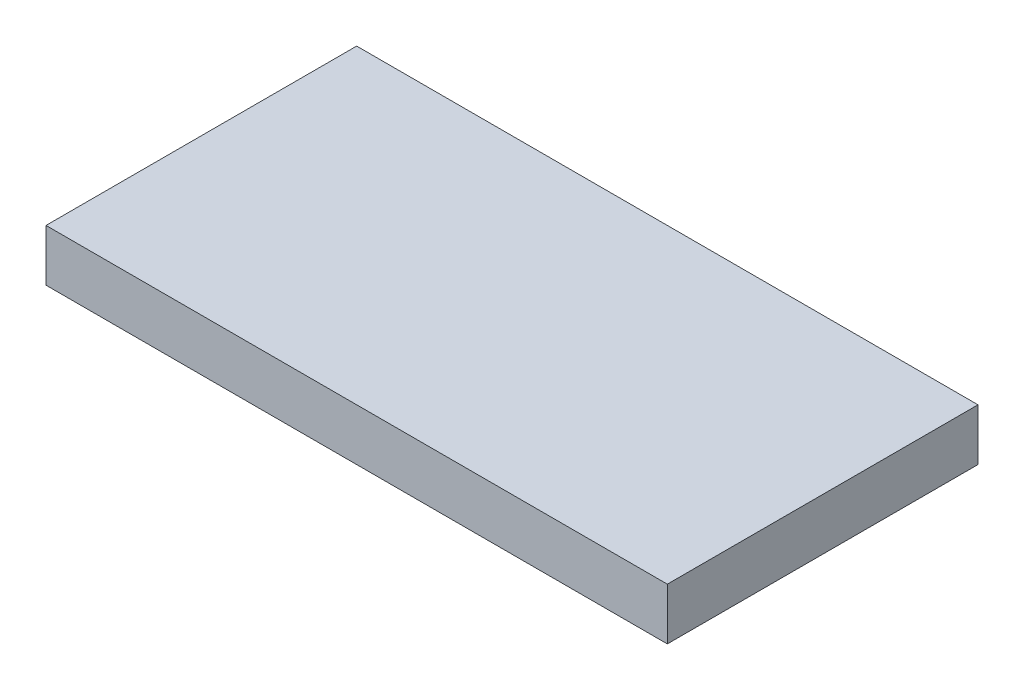
from build123d import *

# Parameters (mm, degrees)
SKETCH1_W           = 24
SKETCH1_H           = 12
BOSS_EXTRUDE1_DEPTH = 2


with BuildPart() as part:
    # Sketch1 → Boss-Extrude1 (new body)
    with BuildSketch(Plane(origin=(0, 0, 0), x_dir=(1, 0, 0), z_dir=(0, 1, 0))):
        Rectangle(SKETCH1_W, SKETCH1_H)
    extrude(amount=BOSS_EXTRUDE1_DEPTH)


solid = part.part
